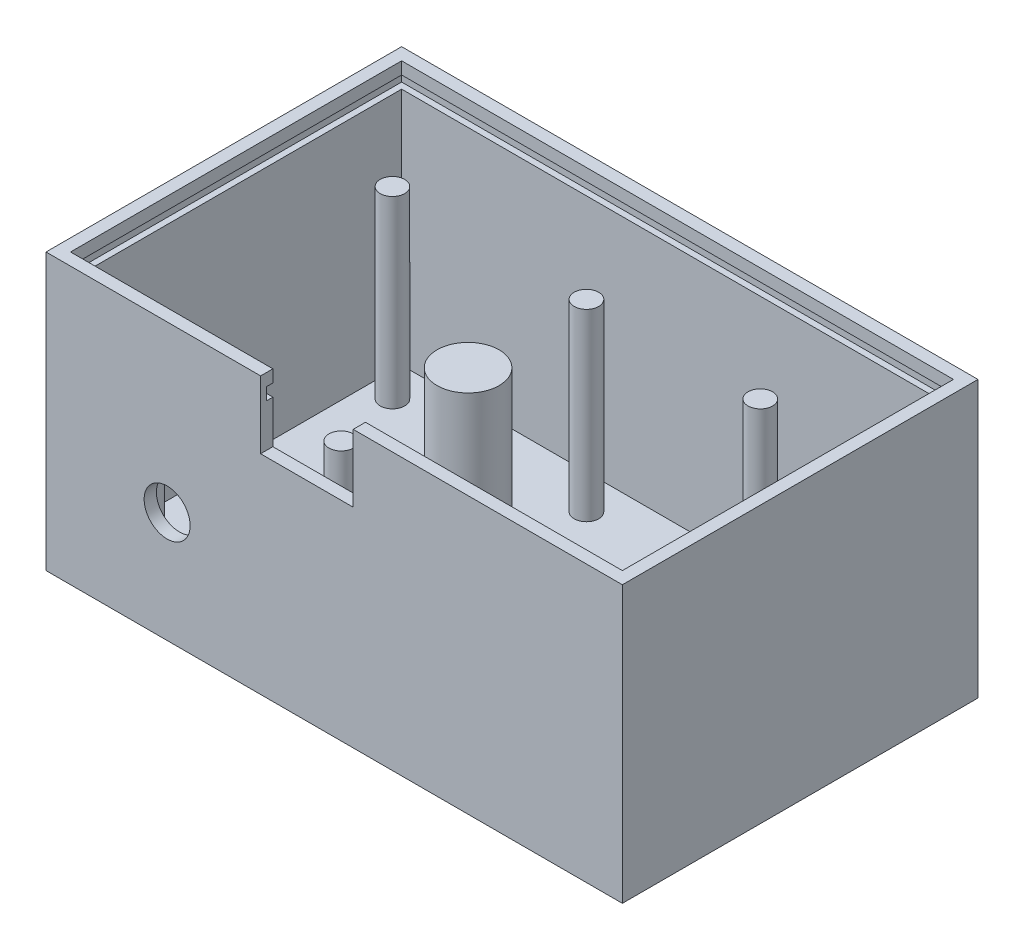
from build123d import *

# Parameters (mm, degrees)
SKETCH1_W           = 94
SKETCH1_H           = 58
BOSS_EXTRUDE1_DEPTH = 45
SKETCH2_W           = 90
SKETCH2_H           = 54
CUT_EXTRUDE1_DEPTH  = 43
SKETCH6_W           = 92
SKETCH6_H           = 56
CUT_EXTRUDE2_DEPTH  = 2
SKETCH10_R          = 2
SKETCH10_R_2        = 5.056057686
BOSS_EXTRUDE2_DEPTH = 30
SKETCH11_R          = 3.75
CUT_EXTRUDE3_DEPTH  = 2
SKETCH12_W          = 15.1
SKETCH12_H          = 2
CUT_EXTRUDE4_DEPTH  = 11


with BuildPart() as part:
    # Sketch1 → Boss-Extrude1 (new body)
    with BuildSketch(Plane(origin=(0, 0, 0), x_dir=(1, 0, 0), z_dir=(0, 1, 0))):
        with Locations((47, 29)):
            Rectangle(SKETCH1_W, SKETCH1_H)
    extrude(amount=BOSS_EXTRUDE1_DEPTH)

    # Sketch2 → Cut-Extrude1 (cut)
    with BuildSketch(Plane(origin=(0, 45, 0), x_dir=(1, 0, 0), z_dir=(0, 1, 0))):
        with Locations((47, 29)):
            Rectangle(SKETCH2_W, SKETCH2_H)
    extrude(amount=-CUT_EXTRUDE1_DEPTH, mode=Mode.SUBTRACT)

    # Sketch6 → Cut-Extrude2 (cut)
    with BuildSketch(Plane(origin=(0, 43, 0), x_dir=(-1, 0, 0), z_dir=(0, -1, 0))):
        with Locations((-47, 29)):
            Rectangle(SKETCH6_W, SKETCH6_H)
    extrude(amount=CUT_EXTRUDE2_DEPTH, mode=Mode.SUBTRACT)

    # Sketch10 → Boss-Extrude2 (add)
    with BuildSketch(Plane(origin=(0, 2, 0), x_dir=(1, 0, 0), z_dir=(0, 1, 0))):
        with Locations(Location((6, 50.5, 0), (0, 0, 90))):
            Circle(SKETCH10_R)
        with Locations(Location((66, 50.5, 0), (0, 0, 90))):
            Circle(SKETCH10_R)
        with Locations(Location((6, 10.5, 0), (0, 0, 90))):
            Circle(SKETCH10_R)
        with Locations(Location((66, 10.5, 0), (0, 0, 90))):
            Circle(SKETCH10_R)
        with Locations(Location((37.761829649, 50.378957989, 0), (0, 0, 90))):
            Circle(SKETCH10_R)
        with Locations(Location((37.761829649, 10.378957989, 0), (0, 0, 90))):
            Circle(SKETCH10_R)
        with Locations(Location((37.761829649, 31.073572918, 0), (0, 0, 90))):
            Circle(SKETCH10_R_2)
    extrude(amount=BOSS_EXTRUDE2_DEPTH)

    # Sketch11 → Cut-Extrude3 (cut)
    with BuildSketch(Plane.XY):
        with Locations((19.755158367, 18.08373087)):
            Circle(SKETCH11_R)
    extrude(amount=-CUT_EXTRUDE3_DEPTH, mode=Mode.SUBTRACT)

    # Sketch12 → Cut-Extrude4 (cut)
    with BuildSketch(Plane(origin=(0, 45, 0), x_dir=(1, 0, 0), z_dir=(0, 1, 0))):
        with Locations((42.55, 1)):
            Rectangle(SKETCH12_W, SKETCH12_H)
    extrude(amount=-CUT_EXTRUDE4_DEPTH, mode=Mode.SUBTRACT)


solid = part.part
